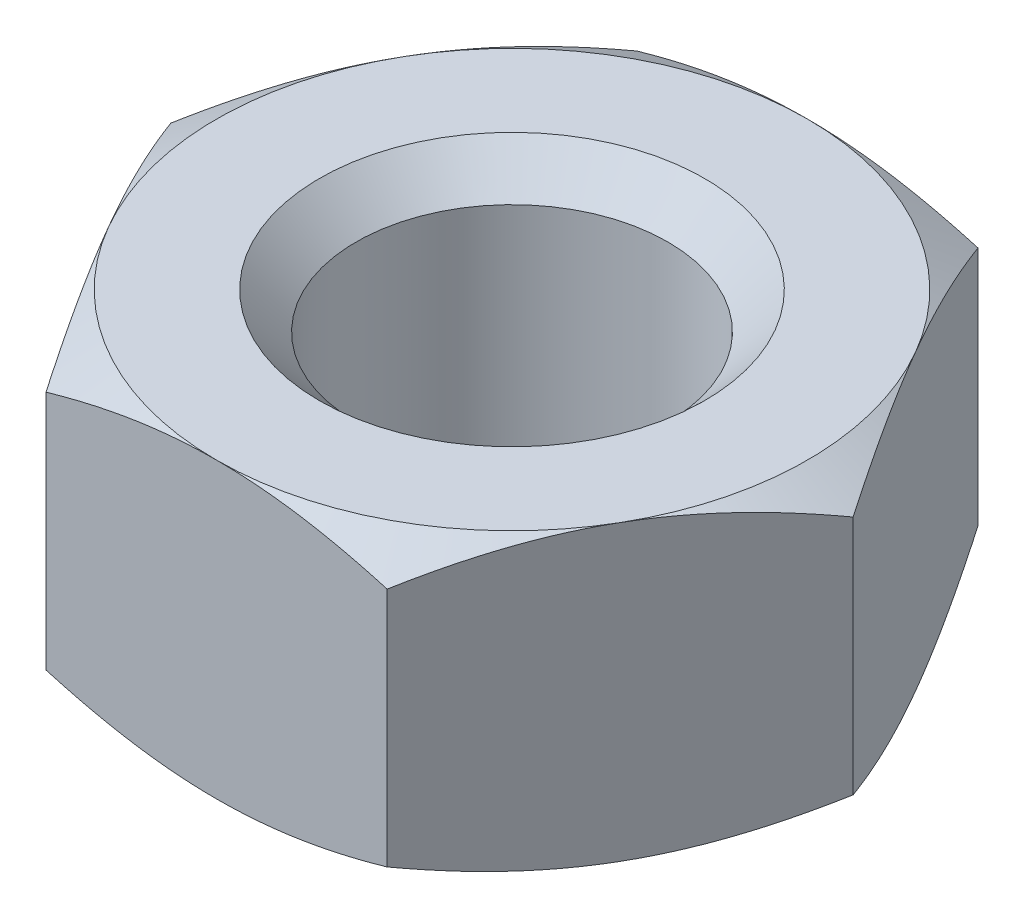
from build123d import *

# Parameters (mm, degrees)
EXTRUDE_1_DEPTH     = 8
SKETCH_2_OUTSIDE_W  = 53.488
SKETCH_2_OUTSIDE_H  = 50.996
SKETCH_2_OUTSIDE_R  = 8.054036255
CUT_EXTRUDE_2_DEPTH = 8
CUT_EXTRUDE_2_DRAFT = -60
SKETCH_3_OUTSIDE_W  = 53.488
SKETCH_3_OUTSIDE_H  = 50.996
SKETCH_3_OUTSIDE_R  = 8.054036255
CUT_EXTRUDE_3_DEPTH = 8
CUT_EXTRUDE_3_DRAFT = -60
SKETCH_4_R          = 4.25
CUT_EXTRUDE_4_DEPTH = 15.675063884
CHAMFER_1_SIZE      = 1


with BuildPart() as part:
    # Эскиз1 → Бобышка-Вытянуть1 (new body)
    with BuildSketch(Plane(origin=(0, 0, 0), x_dir=(1, 0, 0), z_dir=(0, 1, 0))):
        Polygon((9.3, 0), (4.65, 8.054036255), (-4.65, 8.054036255), (-9.3, 0), (-4.65, -8.054036255), (4.65, -8.054036255), align=None)
    extrude(amount=EXTRUDE_1_DEPTH)


with BuildPart() as cut_extrude_2_tool:
    # Эскиз2 outside → Вырез-Вытянуть2 (with draft: the straight prism first)
    with BuildSketch(Plane(origin=(0, 8, 0), x_dir=(1, 0, 0), z_dir=(0, 1, 0))):
        Rectangle(SKETCH_2_OUTSIDE_W, SKETCH_2_OUTSIDE_H)
        Circle(SKETCH_2_OUTSIDE_R, mode=Mode.SUBTRACT)
    extrude(amount=-CUT_EXTRUDE_2_DEPTH)
    # Вырез-Вытянуть2: the draft: its side faces are tilted about the plane it starts from
    cut_extrude_2_sides = [cut_extrude_2_tool.faces().sort_by_distance(p)[0] for p in [
        (0, 4, 25.498),
        (26.744, 4, 0),
        (0, 4, -25.498),
        (-26.744, 4, 0),
        (-8.054036255, 4, 0),
    ]]
    draft(cut_extrude_2_sides, Plane(origin=(0, 8, 0), x_dir=(1, 0, 0), z_dir=(0, 1, 0)), CUT_EXTRUDE_2_DRAFT)


with BuildPart() as part_1:
    add(part.part)

    # Вырез-Вытянуть2: cut by cut_extrude_2_tool
    add(cut_extrude_2_tool.part, mode=Mode.SUBTRACT)


with BuildPart() as cut_extrude_3_tool:
    # Эскиз3 outside → Вырез-Вытянуть3 (with draft: the straight prism first)
    with BuildSketch(Plane.XZ):
        Rectangle(SKETCH_3_OUTSIDE_W, SKETCH_3_OUTSIDE_H)
        Circle(SKETCH_3_OUTSIDE_R, mode=Mode.SUBTRACT)
    extrude(amount=-CUT_EXTRUDE_3_DEPTH)
    # Вырез-Вытянуть3: the draft: its side faces are tilted about the plane it starts from
    cut_extrude_3_sides = [cut_extrude_3_tool.faces().sort_by_distance(p)[0] for p in [
        (0, 4, -25.498),
        (26.744, 4, 0),
        (0, 4, 25.498),
        (-26.744, 4, 0),
        (-8.054036255, 4, 0),
    ]]
    draft(cut_extrude_3_sides, Plane.XZ, CUT_EXTRUDE_3_DRAFT)


with BuildPart() as part_2:
    add(part_1.part)

    # Вырез-Вытянуть3: cut by cut_extrude_3_tool
    add(cut_extrude_3_tool.part, mode=Mode.SUBTRACT)

    # Эскиз4 → Вырез-Вытянуть4 (cut, through all)
    with BuildSketch(Plane.XZ):
        with Locations(Location((0, 0, 0), (0, 0, 270))):
            Circle(SKETCH_4_R)
    extrude(amount=-CUT_EXTRUDE_4_DEPTH, mode=Mode.SUBTRACT)

    # Фаска1
    chamfer_1_edges = [part_2.edges().sort_by_distance(p)[0] for p in [
        (0, 8, 4.25),
        (0, 0, 4.25),
    ]]
    chamfer(chamfer_1_edges, length=CHAMFER_1_SIZE)


solid = part_2.part
